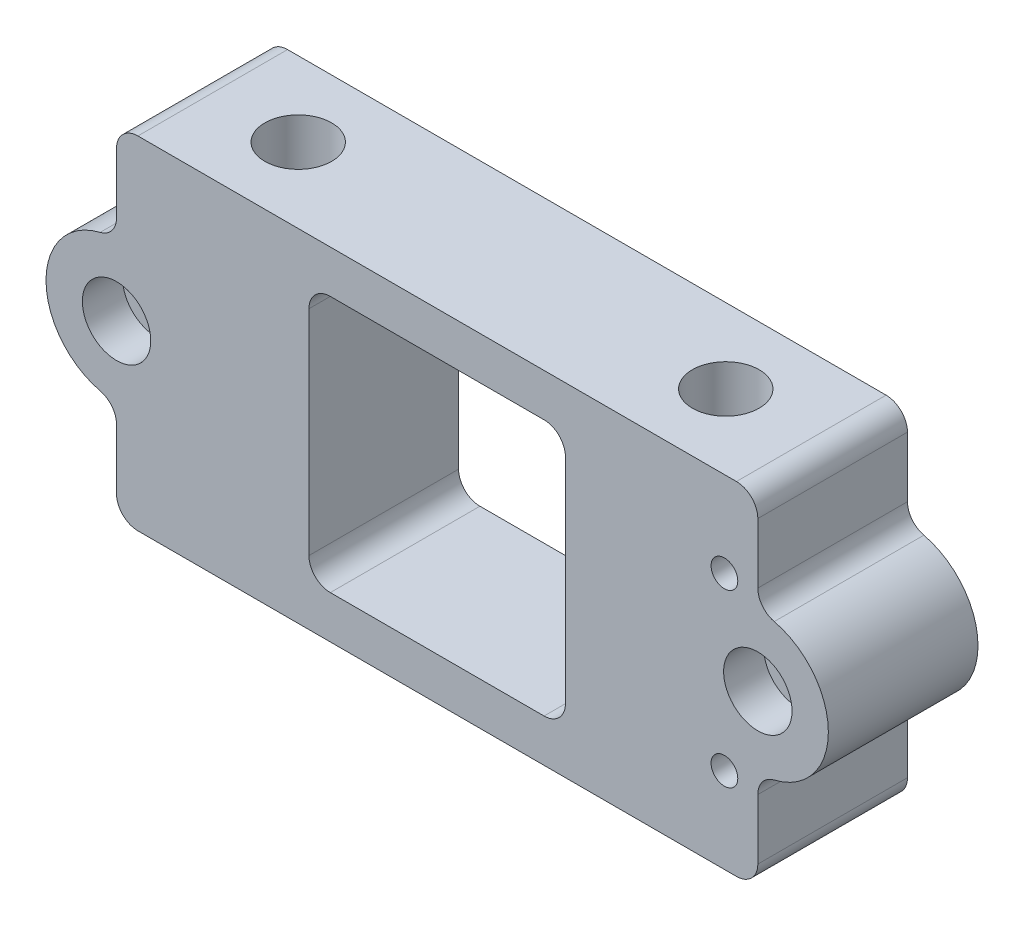
from build123d import *

# Parameters (mm, degrees)
SKETCH1_W           = 93.6625
SKETCH1_H           = 40.64
SKETCH1_R           = 2.4892
SKETCH1_R_2         = 1.5875
BOSS_EXTRUDE1_DEPTH = 17.78
SKETCH6_R           = 3.96875
CUT_EXTRUDE4_DEPTH  = 104.635910312
CUT_EXTRUDE3_DEPTH  = 17.78
FILLET1_R           = 2.54
SKETCH3_R           = 4.064
CUT_EXTRUDE5_DEPTH  = 4.7752
CUT_EXTRUDE6_DEPTH  = 98.141100599


with BuildPart() as part:
    # Sketch1 → Boss-Extrude1 (new body)
    with BuildSketch(Plane.XY):
        with Locations((-46.83125, 0)):
            Rectangle(SKETCH1_W, SKETCH1_H)
        with Locations((-84.93125, 0)):
            Circle(SKETCH1_R, mode=Mode.SUBTRACT)
        with Locations((-8.73125, 0)):
            Circle(SKETCH1_R, mode=Mode.SUBTRACT)
        with Locations((-12.7, 10.16)):
            Circle(SKETCH1_R_2, mode=Mode.SUBTRACT)
        with Locations((-12.7, -10.16)):
            Circle(SKETCH1_R_2, mode=Mode.SUBTRACT)
    extrude(amount=-BOSS_EXTRUDE1_DEPTH)

    # Sketch6 → Cut-Extrude4 (cut, through all)
    with BuildSketch(Plane(origin=(0, 20.32, 0), x_dir=(1, 0, 0), z_dir=(0, 1, 0))):
        with Locations(Location((-72.23125, 8.89, 0), (0, 0, 270))):
            Circle(SKETCH6_R)
        with Locations(Location((-21.43125, 8.89, 0), (0, 0, 270))):
            Circle(SKETCH6_R)
    extrude(amount=-CUT_EXTRUDE4_DEPTH, mode=Mode.SUBTRACT)

    # Sketch5 → Cut-Extrude3 (cut)
    with BuildSketch(Plane.XY):
        with BuildLine():
            Line((-93.6625, -20.32), (-93.6625, 20.32))
            Line((-93.6625, 20.32), (-84.93125, 20.32))
            Line((-84.93125, 20.32), (-84.93125, 10.622546022))
            ThreePointArc((-84.93125, 10.622546022), (-85.477262526, 9.049137635), (-86.880552326, 8.152186482))
            ThreePointArc((-86.880552326, 8.152186482), (-93.31325, 0), (-86.880552326, -8.152186482))
            ThreePointArc((-86.880552326, -8.152186482), (-85.477262526, -9.049137635), (-84.93125, -10.622546022))
            Line((-84.93125, -10.622546022), (-84.93125, -20.32))
            Line((-84.93125, -20.32), (-93.6625, -20.32))
        make_face()
        with BuildLine():
            Line((0, -20.32), (0, 20.32))
            Line((0, 20.32), (-8.73125, 20.32))
            Line((-8.73125, 20.32), (-8.73125, 10.622546022))
            ThreePointArc((-8.73125, 10.622546022), (-8.185237474, 9.049137635), (-6.781947674, 8.152186482))
            ThreePointArc((-6.781947674, 8.152186482), (-0.34925, 0), (-6.781947674, -8.152186482))
            ThreePointArc((-6.781947674, -8.152186482), (-8.185237474, -9.049137635), (-8.73125, -10.622546022))
            Line((-8.73125, -10.622546022), (-8.73125, -20.32))
            Line((-8.73125, -20.32), (0, -20.32))
        make_face()
    extrude(amount=-CUT_EXTRUDE3_DEPTH, mode=Mode.SUBTRACT)

    # Fillet1
    fillet1_edges = [part.edges().sort_by_distance(p)[0] for p in [
        (-84.93125, 20.32, -8.89),
        (-84.93125, -20.32, -8.89),
        (-8.73125, 20.32, -8.89),
        (-8.73125, -20.32, -8.89),
    ]]
    fillet(fillet1_edges, radius=FILLET1_R)

    # Sketch3 → Cut-Extrude5 (cut)
    with BuildSketch(Plane.XY):
        with Locations((-84.93125, 0)):
            Circle(SKETCH3_R)
        with Locations((-8.73125, 0)):
            Circle(SKETCH3_R)
    extrude(amount=-CUT_EXTRUDE5_DEPTH, mode=Mode.SUBTRACT)

    # Sketch7 → Cut-Extrude6 (cut, through all)
    with BuildSketch(Plane.XY):
        with BuildLine():
            Line((-59.53125, -15.24), (-34.13125, -15.24))
            ThreePointArc((-34.13125, -15.24), (-32.335198776, -14.496051224), (-31.59125, -12.7))
            Line((-31.59125, -12.7), (-31.59125, 12.7))
            ThreePointArc((-31.59125, 12.7), (-32.335198776, 14.496051224), (-34.13125, 15.24))
            Line((-34.13125, 15.24), (-59.53125, 15.24))
            ThreePointArc((-59.53125, 15.24), (-61.327301224, 14.496051224), (-62.07125, 12.7))
            Line((-62.07125, 12.7), (-62.07125, -12.7))
            ThreePointArc((-62.07125, -12.7), (-61.327301224, -14.496051224), (-59.53125, -15.24))
        make_face()
    extrude(amount=-CUT_EXTRUDE6_DEPTH, mode=Mode.SUBTRACT)


solid = part.part
